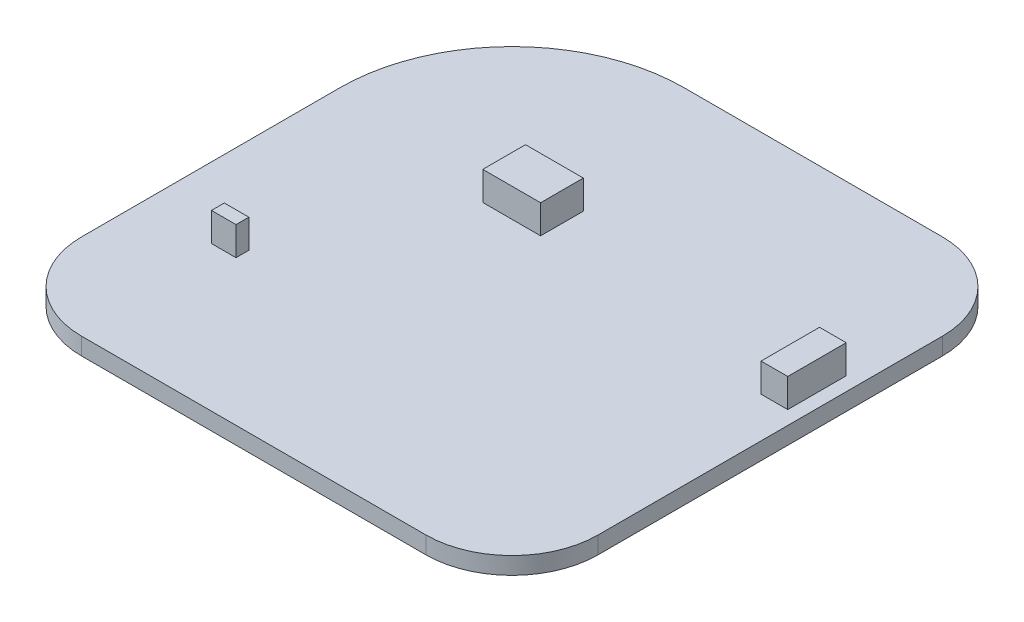
from build123d import *

# Parameters (mm, degrees)
BOSS_EXTRUDE1_DEPTH = 2
SCALE1_SCALE        = 0.9
SKETCH3_W           = 6.046779213
SKETCH3_H           = 4.468776405
BOSS_EXTRUDE2_DEPTH = 3
SKETCH4_W           = 2.790397576
SKETCH4_H           = 6.115363286
BOSS_EXTRUDE3_DEPTH = 3
SKETCH5_W           = 2.56611171
SKETCH5_H           = 1.346193589
BOSS_EXTRUDE4_DEPTH = 3


with BuildPart() as part:
    # Sketch2 → Boss-Extrude1 (new body)
    with BuildSketch(Plane(origin=(0, 0, 0), x_dir=(1, 0, 0), z_dir=(0, 1, 0))):
        with BuildLine():
            Line((-10, 30), (20, 30))
            ThreePointArc((20, 30), (27.071067812, 27.071067812), (30, 20))
            Line((30, 20), (30, -20))
            ThreePointArc((30, -20), (27.071067812, -27.071067812), (20, -30))
            Line((20, -30), (-20, -30))
            ThreePointArc((-20, -30), (-27.071067812, -27.071067812), (-30, -20))
            Line((-30, -20), (-30, 10))
            ThreePointArc((-30, 10), (-24.142135624, 24.142135624), (-10, 30))
        make_face()
    extrude(amount=BOSS_EXTRUDE1_DEPTH)


with BuildPart() as part_1:
    # Scale1: scaled about (0.462600785, 1, 0.462600785)
    add(part.part.scale(SCALE1_SCALE).moved(Location((0.046260078, 0.1, 0.046260078))))

    # Sketch3 → Boss-Extrude2 (add)
    with BuildSketch(Plane(origin=(0, 1.9, 0), x_dir=(1, 0, 0), z_dir=(0, 1, 0))):
        with Locations((-6.068725182, 8.270529837)):
            Rectangle(SKETCH3_W, SKETCH3_H)
    extrude(amount=BOSS_EXTRUDE2_DEPTH)

    # Sketch4 → Boss-Extrude3 (add)
    with BuildSketch(Plane(origin=(0, 1.9, 0), x_dir=(1, 0, 0), z_dir=(0, 1, 0))):
        with Locations((24.212308402, 6.281277774)):
            Rectangle(SKETCH4_W, SKETCH4_H)
    extrude(amount=BOSS_EXTRUDE3_DEPTH)

    # Sketch5 → Boss-Extrude4 (add)
    with BuildSketch(Plane(origin=(0, 1.9, 0), x_dir=(1, 0, 0), z_dir=(0, 1, 0))):
        with Locations((-18.275730646, -11.196811513)):
            Rectangle(SKETCH5_W, SKETCH5_H)
    extrude(amount=BOSS_EXTRUDE4_DEPTH)


solid = part_1.part
